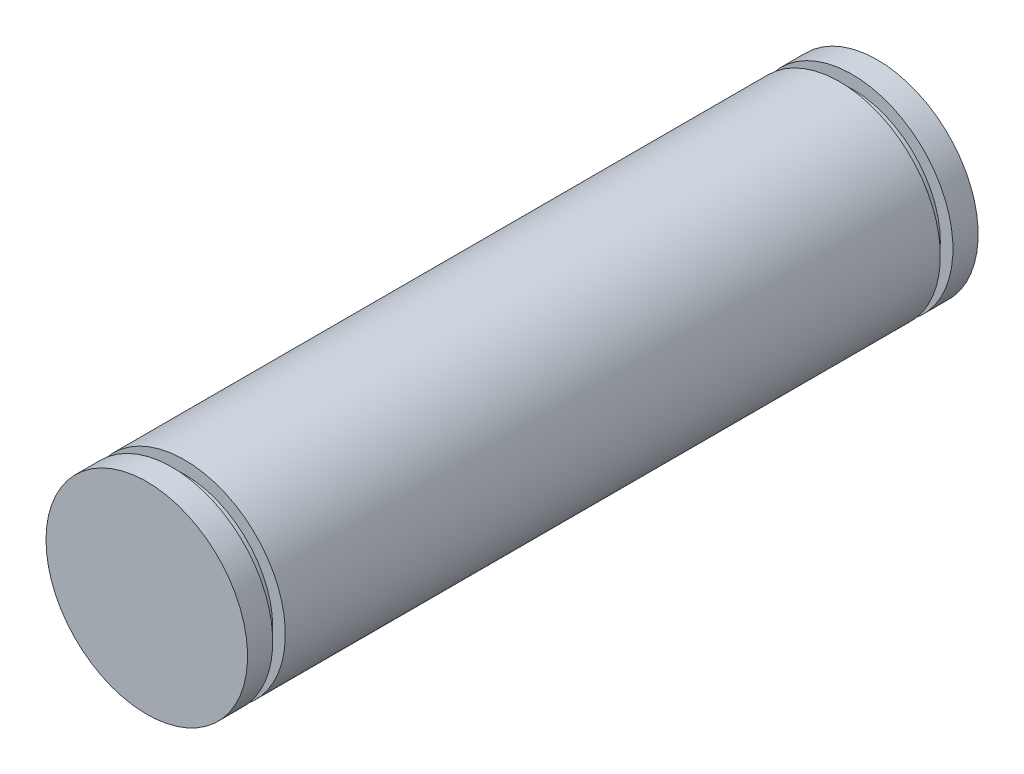
from build123d import *

# Parameters (mm, degrees)
SKETCH1_R           = 8
BOSS_EXTRUDE1_DEPTH = 58
SKETCH2_OUTSIDE_W   = 30.452
SKETCH2_OUTSIDE_H   = 30.452
SKETCH2_OUTSIDE_R   = 7
CUT_EXTRUDE1_DEPTH  = 1


with BuildPart() as part:
    # Sketch1 → Boss-Extrude1 (new body)
    with BuildSketch(Plane.XY):
        with Locations(Location((0, 0, 0), (0, 0, 180))):
            Circle(SKETCH1_R)
    extrude(amount=BOSS_EXTRUDE1_DEPTH)

    # Sketch2 outside → Cut-Extrude1 (cut)
    with BuildSketch(Plane.XY.offset(56)):
        Rectangle(SKETCH2_OUTSIDE_W, SKETCH2_OUTSIDE_H)
        Circle(SKETCH2_OUTSIDE_R, mode=Mode.SUBTRACT)
    cut_extrude1 = extrude(amount=-CUT_EXTRUDE1_DEPTH, mode=Mode.SUBTRACT)

    # Mirror1: Cut-Extrude1 across plane
    add(cut_extrude1.mirror(Plane.XY.offset(29)), mode=Mode.SUBTRACT)


solid = part.part
